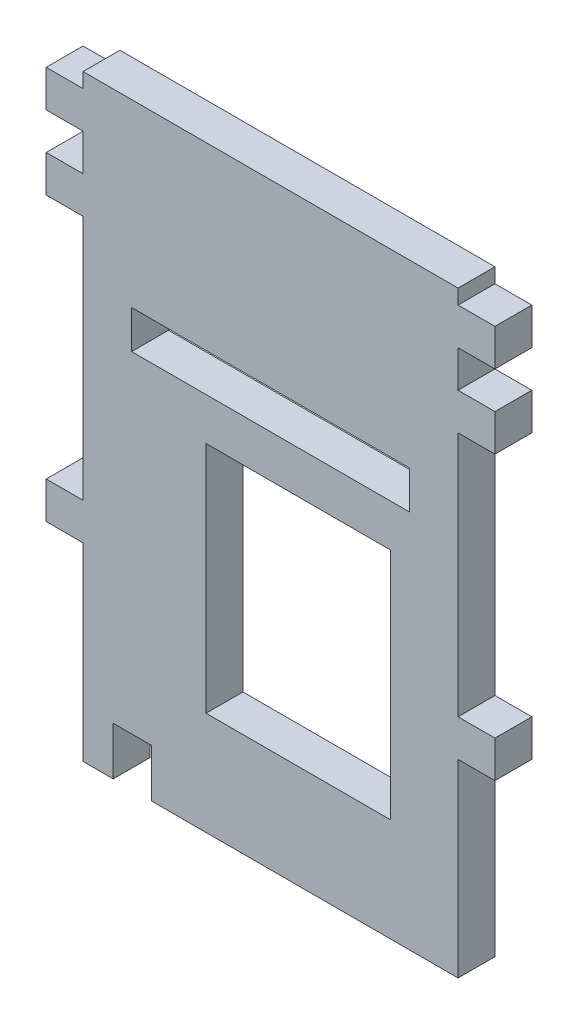
from build123d import *

# Parameters (mm, degrees)
PROFILE_LASER_PROFILE_3MM_W   = 22.6
PROFILE_LASER_PROFILE_3MM_H   = 3.1
PROFILE_LASER_PROFILE_3MM_W_2 = 15
PROFILE_LASER_PROFILE_3MM_H_2 = 19
LASER_PROFILE_3MM_DEPTH       = 3


with BuildPart() as part:
    # Profile_Laser_profile_3mm → Laser_profile_3mm (new body)
    with BuildSketch(Plane.XY):
        Polygon((0, -42.4), (2.45, -42.4), (2.45, -38.48), (5.55, -38.48), (5.55, -42.4), (30.5, -42.4), (30.5, -27), (33.5, -27), (33.5, -24), (30.5, -24), (30.5, -4), (33.5, -4), (33.5, -1), (30.5, -1), (30.5, 2), (33.5, 2), (33.5, 5), (30.5, 5), (30.5, 6.2), (0, 6.2), (0, 5), (-3, 5), (-3, 2), (0, 2), (0, -1), (-3, -1), (-3, -4), (0, -4), (0, -24), (-3, -24), (-3, -27), (0, -27), align=None)
        with Locations((15.25, -10)):
            Rectangle(PROFILE_LASER_PROFILE_3MM_W, PROFILE_LASER_PROFILE_3MM_H, mode=Mode.SUBTRACT)
        with Locations((17.5, -24.5)):
            Rectangle(PROFILE_LASER_PROFILE_3MM_W_2, PROFILE_LASER_PROFILE_3MM_H_2, mode=Mode.SUBTRACT)
    extrude(amount=LASER_PROFILE_3MM_DEPTH)


solid = part.part
